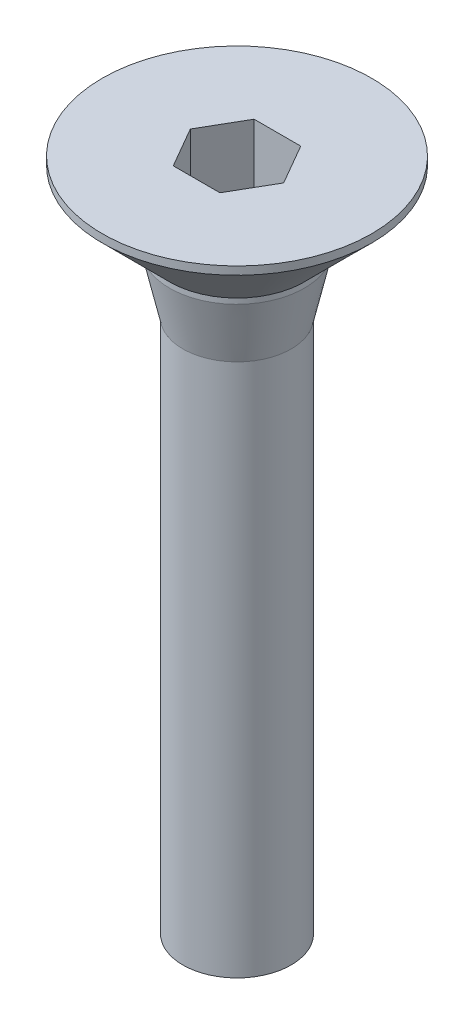
from build123d import *

# Parameters (mm, degrees)
SCHNITT_LINEAR_AUSTRAGEN1_DEPTH = 5.3


with BuildPart() as part:
    # Skizze1 → Basis-Rotation (revolve)
    with BuildSketch(Plane.XY, mode=Mode.PRIVATE) as basis_rotation_sk:
        Polygon((0, 0), (5, 0), (5, -0.3), (2.5, -2.8), (2.5, -3), (2.0095, -5.2), (2.0095, -25), (0, -25), align=None)
    revolve(basis_rotation_sk.sketch.rotate(Axis((0, 0, 0), (0, -1, 0)), 180), axis=Axis((0, 0, 0), (0, -1, 0)))

    # Skizze2 → Schnitt-Linear austragen1 (cut)
    with BuildSketch(Plane(origin=(0, 0, 0), x_dir=(-1, 0, 0), z_dir=(0, 1, 0))):
        Polygon((0.866025404, -1.5), (-0.866025404, -1.5), (-1.732050808, 0), (-0.866025404, 1.5), (0.866025404, 1.5), (1.732050808, 0), align=None)
    extrude(amount=-SCHNITT_LINEAR_AUSTRAGEN1_DEPTH, mode=Mode.SUBTRACT)


solid = part.part
